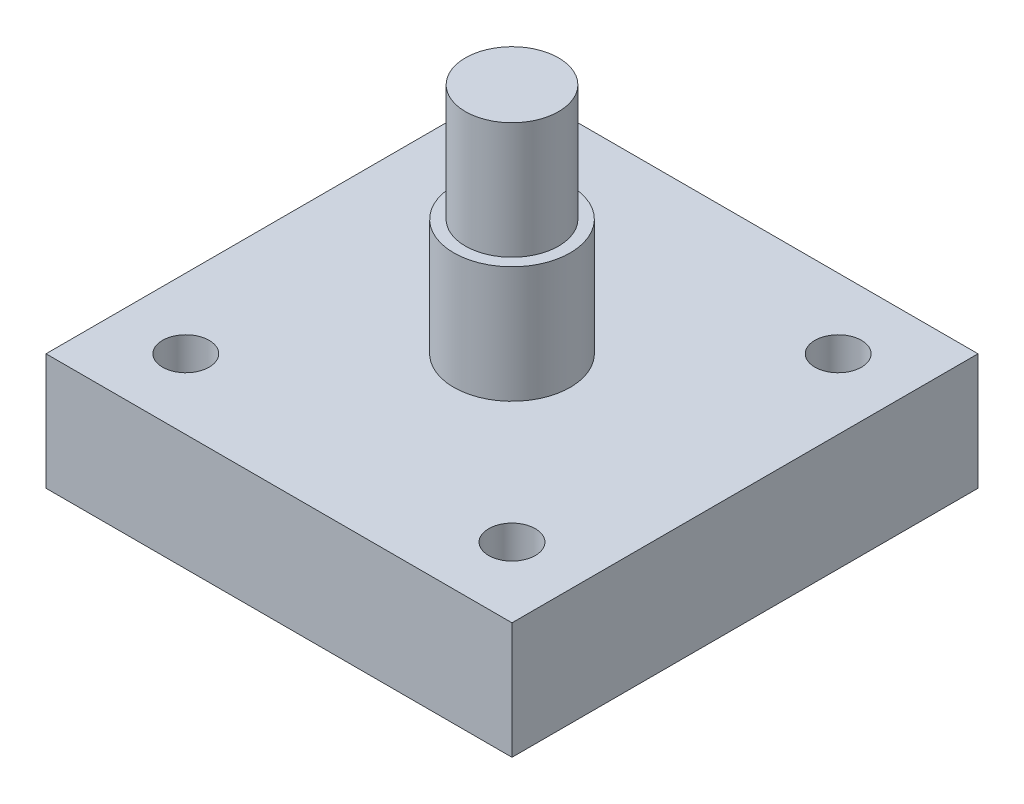
from build123d import *

# Parameters (mm, degrees)
SKETCH1_W           = 20
SKETCH1_H           = 5
BOSS_EXTRUDE1_DEPTH = 20
SKETCH2_R           = 2.5
BOSS_EXTRUDE2_DEPTH = 10
SKETCH3_R           = 1
CUT_EXTRUDE1_DEPTH  = 25.494897428
CUT_EXTRUDE2_START  = -5
SKETCH4_R           = 2.5
SKETCH4_R_2         = 2
CUT_EXTRUDE2_DEPTH  = 5


with BuildPart() as part:
    # Sketch1 → Boss-Extrude1 (new body)
    with BuildSketch(Plane.XY):
        Rectangle(SKETCH1_W, SKETCH1_H)
    extrude(amount=BOSS_EXTRUDE1_DEPTH)

    # Sketch2 → Boss-Extrude2 (add)
    with BuildSketch(Plane(origin=(0, 2.5, 0), x_dir=(1, 0, 0), z_dir=(0, 1, 0))):
        with Locations(Location((0, -10, 0), (0, 0, 270))):
            Circle(SKETCH2_R)
    extrude(amount=BOSS_EXTRUDE2_DEPTH)

    # Sketch3 → Cut-Extrude1 (cut, through all)
    with BuildSketch(Plane(origin=(0, 2.5, 0), x_dir=(1, 0, 0), z_dir=(0, 1, 0))):
        with Locations(Location((-7, -3, 0), (0, 0, 270))):
            Circle(SKETCH3_R)
        with Locations(Location((7, -3, 0), (0, 0, 270))):
            Circle(SKETCH3_R)
        with Locations(Location((-7, -17, 0), (0, 0, 270))):
            Circle(SKETCH3_R)
        with Locations(Location((7, -17, 0), (0, 0, 270))):
            Circle(SKETCH3_R)
    extrude(amount=-CUT_EXTRUDE1_DEPTH, mode=Mode.SUBTRACT)

    # Sketch4 → Cut-Extrude2 (cut)
    with BuildSketch(Plane(origin=(0, 12.5, 0), x_dir=(1, 0, 0), z_dir=(0, 1, 0)).offset(CUT_EXTRUDE2_START)):
        with Locations(Location((0, -10, 0), (0, 0, 270))):
            Circle(SKETCH4_R)
        with Locations(Location((0, -10, 0), (0, 0, 270))):
            Circle(SKETCH4_R_2, mode=Mode.SUBTRACT)
    extrude(amount=CUT_EXTRUDE2_DEPTH, mode=Mode.SUBTRACT)


solid = part.part
